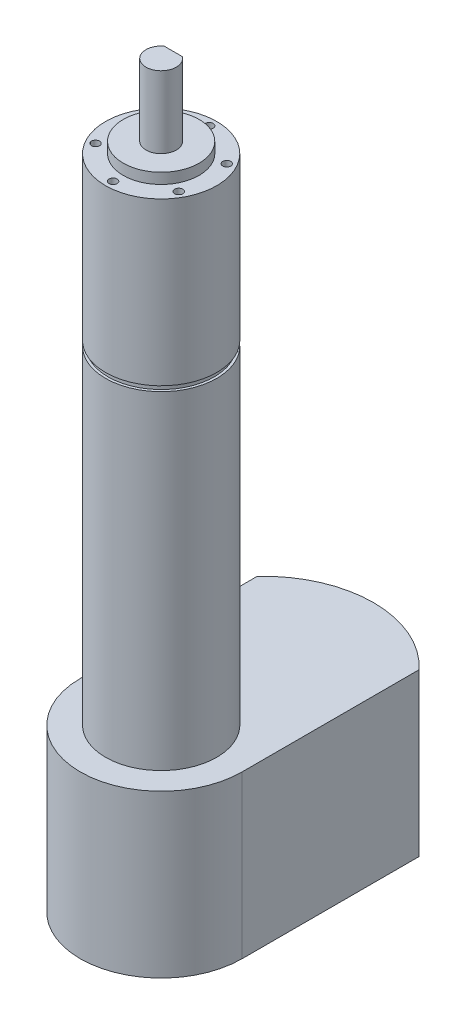
from build123d import *

# Parameters (mm, degrees)
CUT_EXTRUDE_1_DEPTH    = 10.2
EXTRUDE_1_DEPTH        = 32
HOLE_WIZARD_M2_1_D     = 1.6
HOLE_WIZARD_M2_1_DEPTH = 5
HOLE_WIZARD_M2_1_TIP   = 0.480688495


with BuildPart() as part:
    # 草图1 → 旋转1 (revolve)
    with BuildSketch(Plane.XY, mode=Mode.PRIVATE) as revolve_1_sk:
        Polygon((0, 0), (11, 0), (11, 64.9), (10.5, 64.9), (10.5, 65.9), (11, 65.9), (11, 97.9), (7.5, 97.9), (7.5, 100), (3, 100), (3, 114.2), (0, 114.2), align=None)
    revolve(revolve_1_sk.sketch.rotate(Axis((0, 60.650671984, 0), (0, -1, 0)), 90), axis=Axis((0, 60.650671984, 0), (0, -1, 0)))

    # 草图2 → 切除-拉伸1 (cut)
    with BuildSketch(Plane(origin=(0, 114.2, 0), x_dir=(1, 0, 0), z_dir=(0, 1, 0))):
        Polygon((-48.862110032, 2.4), (-1.8, 2.4), (1.8, 2.4), (48.862110032, 2.4), (48.862110032, 96.524220063), (-48.862110032, 96.524220063), align=None)
    extrude(amount=-CUT_EXTRUDE_1_DEPTH, mode=Mode.SUBTRACT)

    # 草图3 → 凸台-拉伸1 (add)
    with BuildSketch(Plane.XZ):
        with BuildLine():
            Line((-16, 0), (-16, -35))
            ThreePointArc((-16, -35), (0, -42), (16, -35))
            Line((16, -35), (16, 0))
            ThreePointArc((16, 0), (0, 16), (-16, 0))
        make_face()
    extrude(amount=EXTRUDE_1_DEPTH)

    # M2 螺纹孔1
    with Locations(Plane(origin=(0, 97.9, 0), x_dir=(1, 0, 0), z_dir=(0, 1, 0))):
        with Locations((0, 9.5), (-8.227241336, 4.75), (-8.227241336, -4.75), (0, -9.5), (8.227241336, -4.75), (8.227241336, 4.75)):
            Hole(HOLE_WIZARD_M2_1_D / 2, depth=HOLE_WIZARD_M2_1_DEPTH)
            with Locations((0, 0, -(HOLE_WIZARD_M2_1_DEPTH + HOLE_WIZARD_M2_1_TIP / 2))):  # 118° drill point
                Cone(0, HOLE_WIZARD_M2_1_D / 2, HOLE_WIZARD_M2_1_TIP, mode=Mode.SUBTRACT)


solid = part.part
